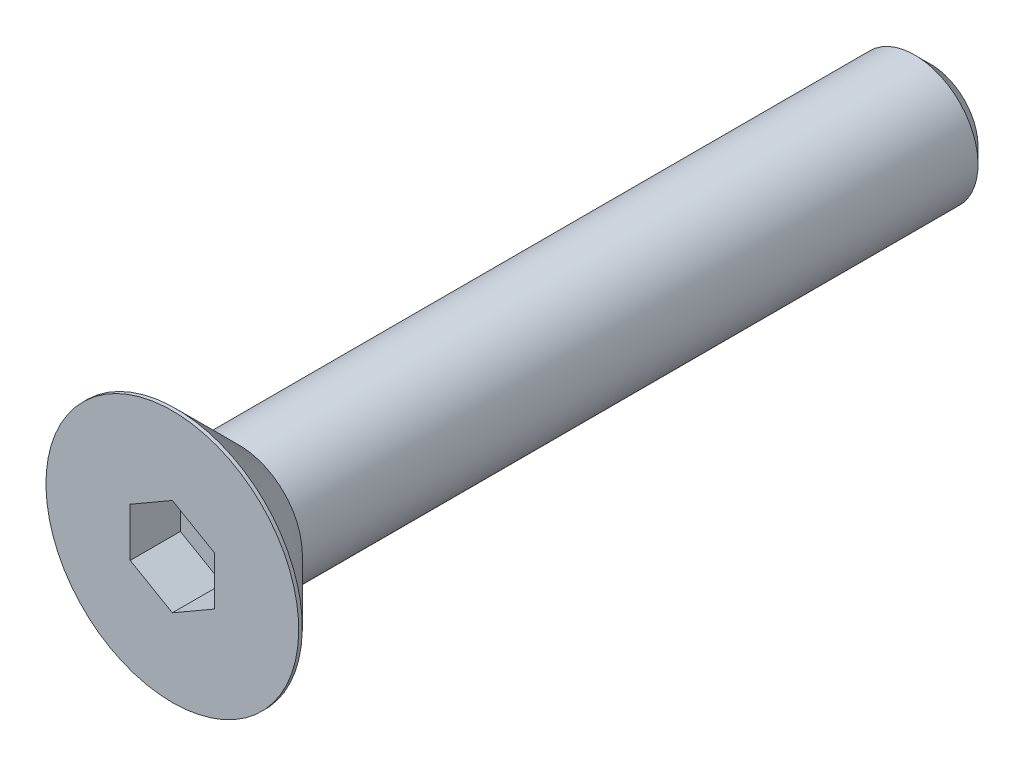
from build123d import *

# Parameters (mm, degrees)
CHAMFER1_SIZE      = 0.375
CUT_EXTRUDE2_DEPTH = 1.19


with BuildPart() as part:
    # Sketch1 → Revolve1 (revolve)
    with BuildSketch(Plane(origin=(0, 0, 0), x_dir=(0, 0, -1), z_dir=(1, 0, 0))):
        Polygon((-7.3, 1.5), (9, 1.5), (9, 0), (-7.81, 0), (-7.81, 1.5), align=None)
    revolve(axis=Axis((0, 0, 7.81), (0, 0, -1)))

    # Chamfer1
    chamfer1_edges = [part.edges().sort_by_distance(p)[0] for p in [
        (0, -1.5, -9),
    ]]
    chamfer(chamfer1_edges, length=CHAMFER1_SIZE)


with BuildPart() as body_2:
    # Sketch7 → Revolve2 (revolve)
    with BuildSketch(Plane(origin=(0, 0, 0), x_dir=(0, 0, -1), z_dir=(1, 0, 0))):
        Polygon((-8.915, 3), (-9, 3), (-9, 0), (-7.3, 0), (-7.3, 1.385), align=None)
    revolve(axis=Axis((0, 0, 9), (0, 0, -1)))

    # Sketch5 → Cut-Extrude2 (cut)
    with BuildSketch(Plane.XY.offset(9)):
        Polygon((1, -0.577350269), (1, 0.577350269), (0, 1.154700538), (-1, 0.577350269), (-1, -0.577350269), (0, -1.154700538), align=None)
    extrude(amount=-CUT_EXTRUDE2_DEPTH, mode=Mode.SUBTRACT)


solid = Compound([part.part, body_2.part])
